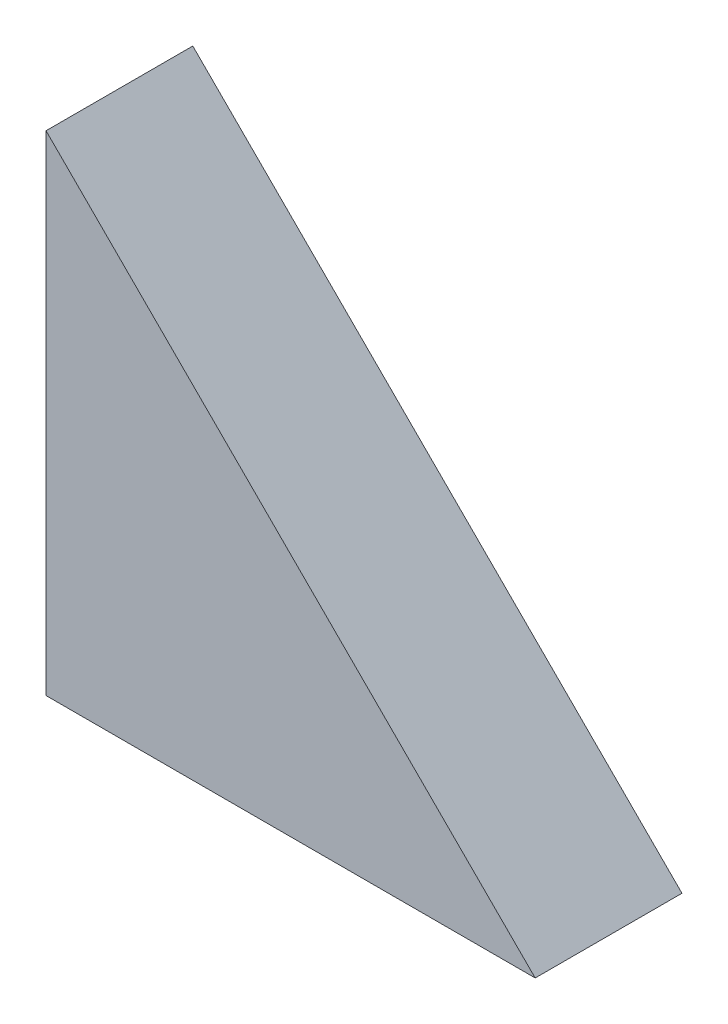
from build123d import *

# Parameters (mm, degrees)
BOSS_EXTRUDE1_DEPTH = 9.525


with BuildPart() as part:
    # Sketch1 → Boss-Extrude1 (new, symmetric)
    with BuildSketch(Plane.XY):
        Polygon((-36.108940535, 118.322011305), (-36.108940535, 54.822011305), (27.391059465, 54.822011305), align=None)
    extrude(amount=BOSS_EXTRUDE1_DEPTH, both=True)


solid = part.part
